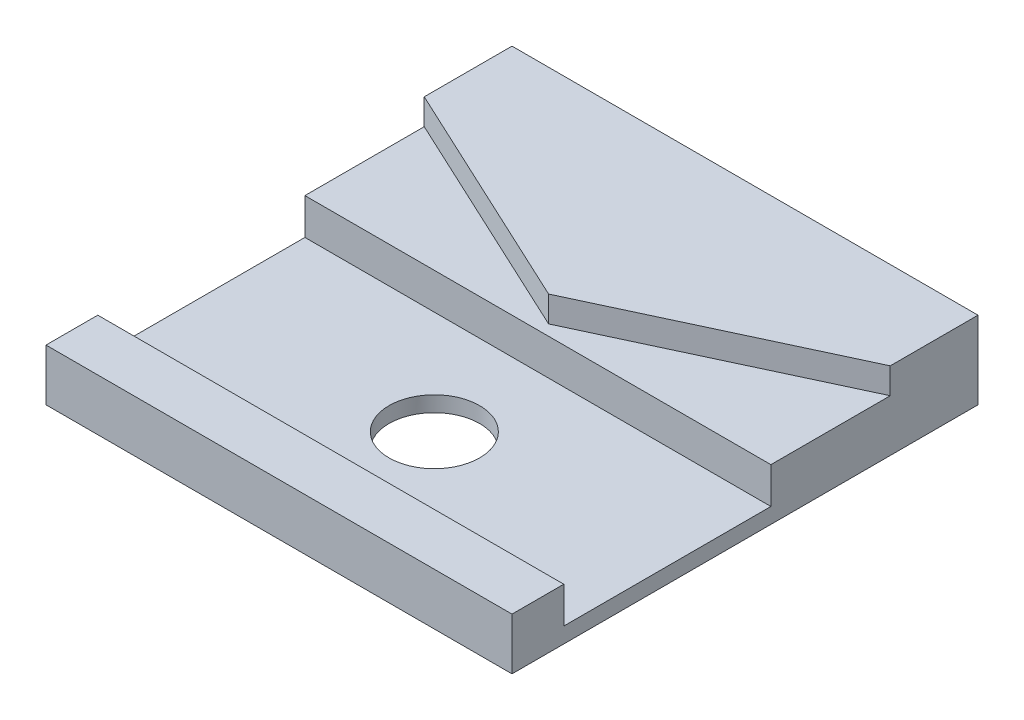
from build123d import *

# Parameters (mm, degrees)
SKETCH1_W                          = 57.15
SKETCH1_H                          = 57.15
BOSS_EXTRUDE1_DEPTH                = 9.525
SKETCH2_W                          = 57.15
SKETCH2_H                          = 25.4
CUT_EXTRUDE1_DEPTH                 = 7.62
F_7_16_0_4375_DIAMETER_HOLE1_D     = 11.1125
F_7_16_0_4375_DIAMETER_HOLE1_DEPTH = 25.4
F_7_16_0_4375_DIAMETER_HOLE1_TIP   = 3.338531814
CUT_EXTRUDE3_DEPTH                 = 3.175
SKETCH9_W                          = 57.15
SKETCH9_H                          = 6.35
CUT_EXTRUDE4_DEPTH                 = 3.175


with BuildPart() as part:
    # Sketch1 → Boss-Extrude1 (new body)
    with BuildSketch(Plane(origin=(0, 0, 0), x_dir=(1, 0, 0), z_dir=(0, 1, 0))):
        Rectangle(SKETCH1_W, SKETCH1_H)
    extrude(amount=BOSS_EXTRUDE1_DEPTH)

    # Sketch2 → Cut-Extrude1 (cut)
    with BuildSketch(Plane(origin=(0, 9.525, 0), x_dir=(1, 0, 0), z_dir=(0, 1, 0))):
        with Locations((0, -9.525)):
            Rectangle(SKETCH2_W, SKETCH2_H)
    extrude(amount=-CUT_EXTRUDE1_DEPTH, mode=Mode.SUBTRACT)

    # 7/16 (0.4375) Diameter Hole1
    with Locations(Plane(origin=(0, 1.905, 0), x_dir=(1, 0, 0), z_dir=(0, 1, 0))):
        with Locations((0, -9.525)):
            Hole(F_7_16_0_4375_DIAMETER_HOLE1_D / 2, depth=F_7_16_0_4375_DIAMETER_HOLE1_DEPTH)
            with Locations((0, 0, -(F_7_16_0_4375_DIAMETER_HOLE1_DEPTH + F_7_16_0_4375_DIAMETER_HOLE1_TIP / 2))):  # 118° drill point
                Cone(0, F_7_16_0_4375_DIAMETER_HOLE1_D / 2, F_7_16_0_4375_DIAMETER_HOLE1_TIP, mode=Mode.SUBTRACT)

    # Sketch8 → Cut-Extrude3 (cut)
    with BuildSketch(Plane(origin=(0, 9.525, 0), x_dir=(1, 0, 0), z_dir=(0, 1, 0))):
        Polygon((0, 4.487899571), (28.575, 17.812640903), (28.575, 3.175), (0, 3.175), align=None)
    cut_extrude3 = extrude(amount=-CUT_EXTRUDE3_DEPTH, mode=Mode.SUBTRACT)

    # Mirror2: Cut-Extrude3 across plane
    add(cut_extrude3.mirror(Plane(origin=(0, 0, 0), x_dir=(0, 0, 1), z_dir=(1, 0, 0))), mode=Mode.SUBTRACT)

    # Sketch9 → Cut-Extrude4 (cut)
    with BuildSketch(Plane(origin=(0, 9.525, 0), x_dir=(1, 0, 0), z_dir=(0, 1, 0))):
        with Locations((0, -25.4)):
            Rectangle(SKETCH9_W, SKETCH9_H)
    extrude(amount=-CUT_EXTRUDE4_DEPTH, mode=Mode.SUBTRACT)


solid = part.part
